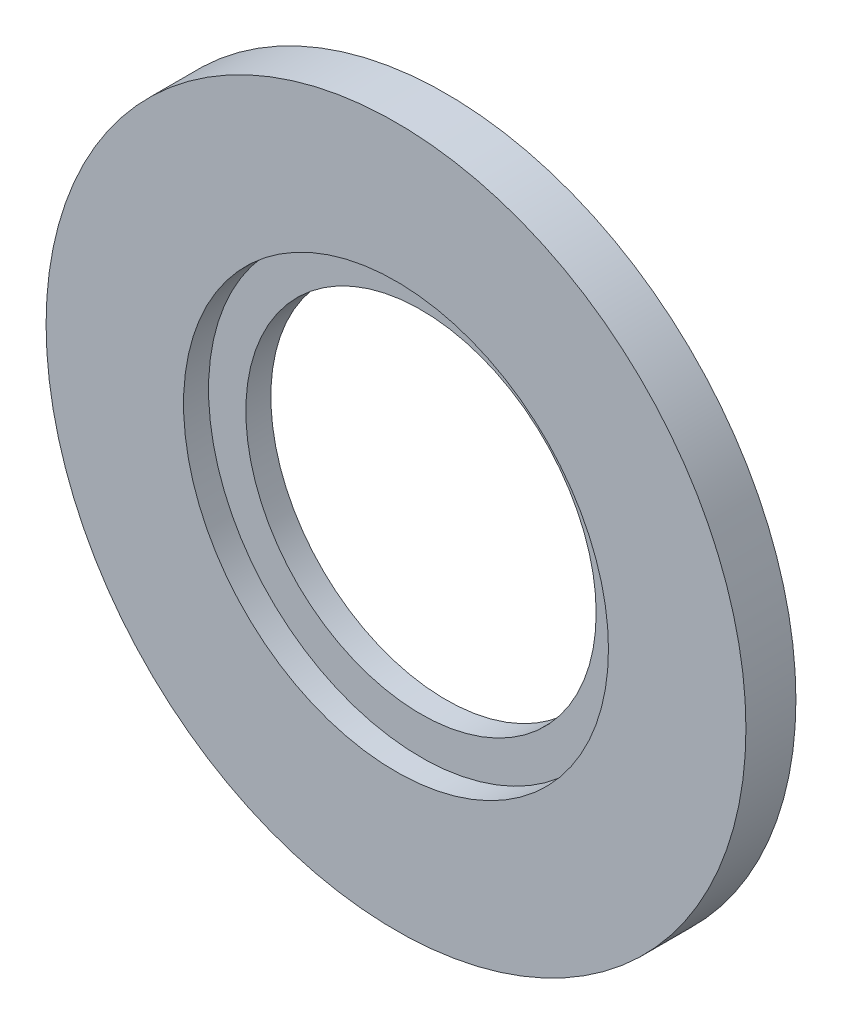
from build123d import *

# Parameters (mm, degrees)
SKETCH1_R           = 22.225
SKETCH1_R_2         = 11.1252
BOSS_EXTRUDE1_DEPTH = 3.175
SKETCH2_R           = 13.49375
CUT_EXTRUDE1_DEPTH  = 1.5875


with BuildPart() as part:
    # Sketch1 → Boss-Extrude1 (new body)
    with BuildSketch(Plane.XY):
        Circle(SKETCH1_R)
        Circle(SKETCH1_R_2, mode=Mode.SUBTRACT)
    extrude(amount=BOSS_EXTRUDE1_DEPTH)

    # Sketch2 → Cut-Extrude1 (cut)
    with BuildSketch(Plane.XY.offset(3.175)):
        Circle(SKETCH2_R)
    extrude(amount=-CUT_EXTRUDE1_DEPTH, mode=Mode.SUBTRACT)


solid = part.part
